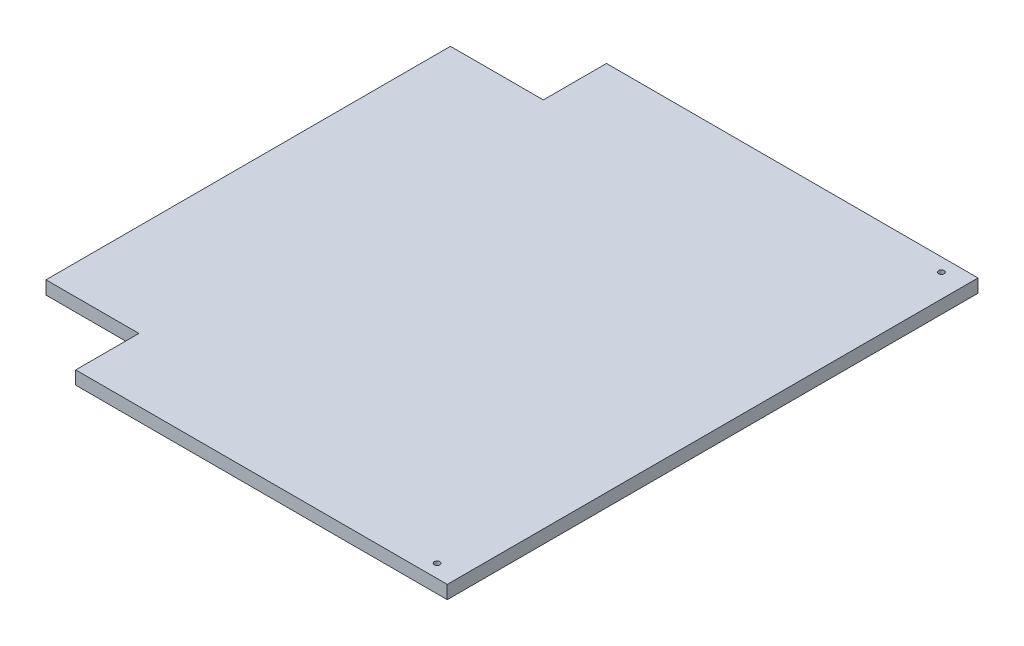
from build123d import *

# Parameters (mm, degrees)
SKETCH1_W           = 444.5
SKETCH1_H           = 508
BOSS_EXTRUDE1_DEPTH = 6.35
SKETCH2_W           = 88.9
SKETCH2_H           = 60.452
CUT_EXTRUDE1_DEPTH  = 230.886
SKETCH3_R           = 2.667
CUT_EXTRUDE2_DEPTH  = 230.886


with BuildPart() as part:
    # Sketch1 → Boss-Extrude1 (new, symmetric)
    with BuildSketch(Plane(origin=(0, 0, 0), x_dir=(1, 0, 0), z_dir=(0, 1, 0))):
        Rectangle(SKETCH1_W, SKETCH1_H)
    extrude(amount=BOSS_EXTRUDE1_DEPTH, both=True)

    # Sketch2 → Cut-Extrude1 (cut)
    with BuildSketch(Plane(origin=(0, 6.35, 0), x_dir=(1, 0, 0), z_dir=(0, 1, 0))):
        with Locations((-177.8, 223.774)):
            Rectangle(SKETCH2_W, SKETCH2_H)
    cut_extrude1 = extrude(amount=-CUT_EXTRUDE1_DEPTH, mode=Mode.SUBTRACT)

    # Mirror1: Cut-Extrude1 across plane
    add(cut_extrude1.mirror(Plane.XY), mode=Mode.SUBTRACT)

    # Sketch3 → Cut-Extrude2 (cut)
    with BuildSketch(Plane(origin=(0, 6.35, 0), x_dir=(1, 0, 0), z_dir=(0, 1, 0))):
        with Locations(Location((199.898, -241.3, 0), (0, 0, 270))):
            Circle(SKETCH3_R)
        with Locations(Location((199.898, 241.3, 0), (0, 0, 270))):
            Circle(SKETCH3_R)
    extrude(amount=-CUT_EXTRUDE2_DEPTH, mode=Mode.SUBTRACT)


solid = part.part
